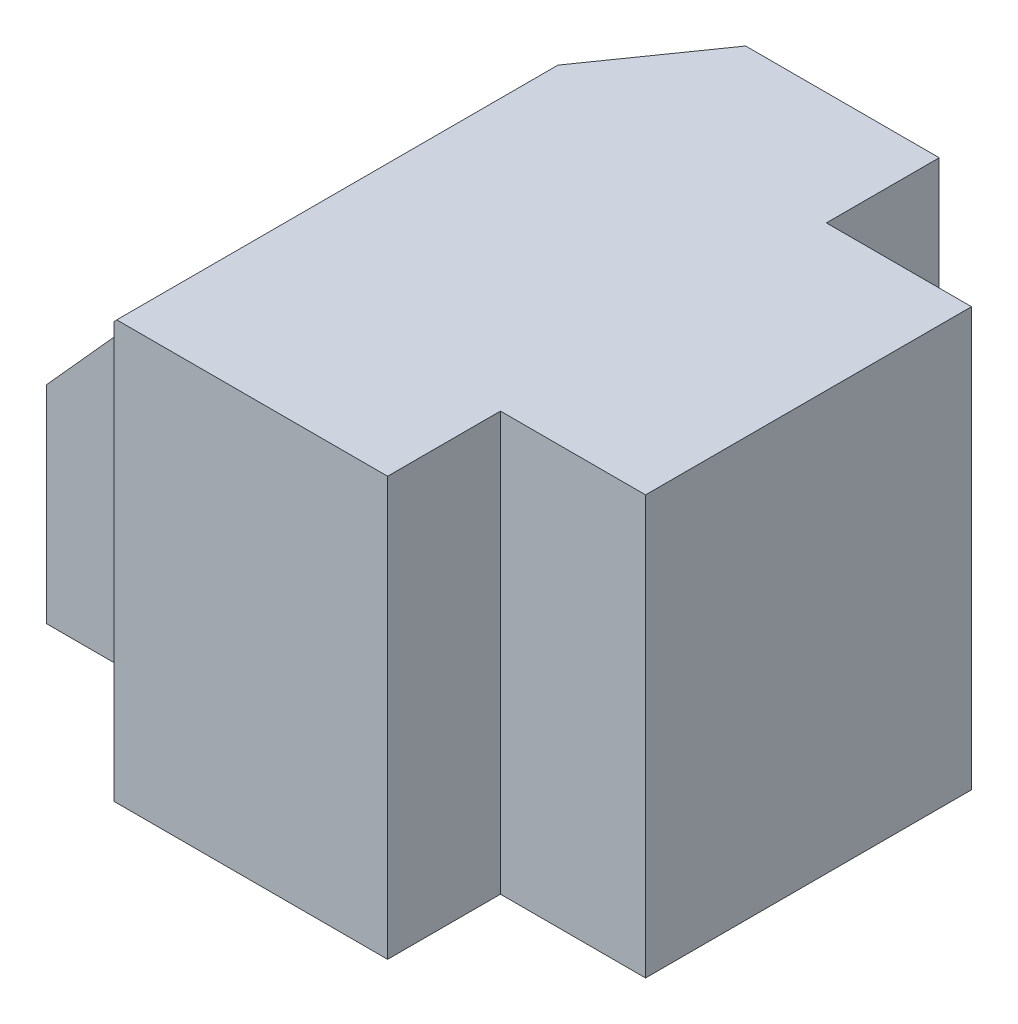
from build123d import *

# Parameters (mm, degrees)
SKETCH1_W           = 64.856187625
SKETCH1_H           = 53.867265469
SKETCH1_W_2         = 50.216999898
SKETCH1_H_2         = 56.395605674
BOSS_EXTRUDE1_DEPTH = 144.78
CHAMFER1_SIZE       = 65.88
CHAMFER1_SIZE2      = 73.167152477
CHAMFER2_SIZE       = 27.78
CHAMFER2_SIZE2      = 39.673951627


with BuildPart() as part:
    # Sketch1 → Boss-Extrude1 (new body)
    with BuildSketch(Plane(origin=(0, 0, 0), x_dir=(1, 0, 0), z_dir=(0, 1, 0))):
        with Locations((-59.723790396, -26.933632735)):
            Rectangle(SKETCH1_W, SKETCH1_H)
        with Locations((-59.723790396, 26.933632735)):
            Rectangle(SKETCH1_W, SKETCH1_H)
        Polygon((-27.295696583, 53.867265469), (-27.295696583, 0), (67.459562421, 0), (67.459562421, 56.395605674), (67.459562421, 95.440559589), (-27.295696583, 95.440559589), align=None)
        Polygon((67.459562421, 0), (-27.295696583, 0), (-27.295696583, -53.867265469), (-27.295696583, -95.440559589), (67.459562421, -95.440559589), (67.459562421, -56.395605674), align=None)
        with Locations((92.56806237, 28.197802837)):
            Rectangle(SKETCH1_W_2, SKETCH1_H_2)
        with Locations((92.56806237, -28.197802837)):
            Rectangle(SKETCH1_W_2, SKETCH1_H_2)
    extrude(amount=BOSS_EXTRUDE1_DEPTH)

    # Chamfer1
    chamfer1_edges = [part.edges().sort_by_distance(p)[0] for p in [
        (-92.151884208, 144.78, 0),
    ]]
    chamfer1_side = [part.faces().sort_by_distance(p)[0] for p in [
        (15.2977171, 144.78, 0),
    ]]
    chamfer(chamfer1_edges, length=CHAMFER1_SIZE, length2=CHAMFER1_SIZE2, reference=chamfer1_side[0])

    # Chamfer2
    chamfer2_edges = [part.edges().sort_by_distance(p)[0] for p in [
        (-27.295696583, 71.821470582, -95.440559589),
    ]]
    chamfer2_side = [part.faces().sort_by_distance(p)[0] for p in [
        (20.083928703, 72.386944526, -95.440559589),
    ]]
    chamfer(chamfer2_edges, length=CHAMFER2_SIZE, length2=CHAMFER2_SIZE2, reference=chamfer2_side[0])


solid = part.part
